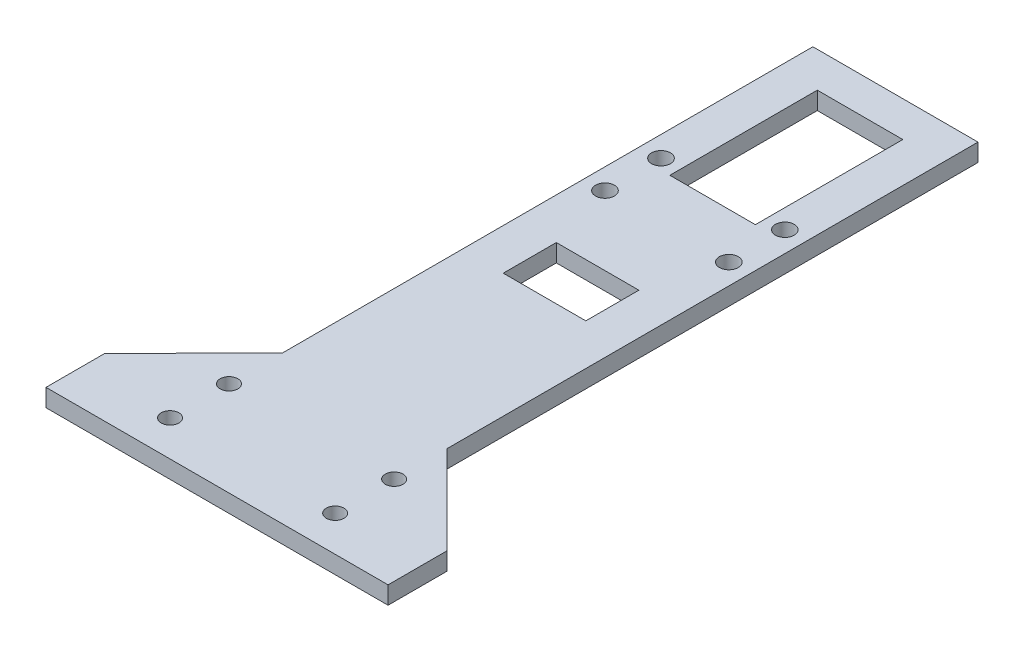
from build123d import *

# Parameters (mm, degrees)
SKETCH1_R           = 1.6
SKETCH1_R_2         = 1.5
SKETCH1_W           = 14
SKETCH1_H           = 9
SKETCH1_W_2         = 14.5
SKETCH1_H_2         = 25
BOSS_EXTRUDE1_DEPTH = 3


with BuildPart() as part:
    # Sketch1 → Boss-Extrude1 (new body)
    with BuildSketch(Plane(origin=(0, 0, 0), x_dir=(1, 0, 0), z_dir=(0, 1, 0))):
        Polygon((0, 0), (0, -90), (15, -105.02919784), (15, -115.02919784), (-43, -115.02919784), (-43, -105.02919784), (-28, -90), (-28, 0), align=None)
        with Locations(Location((-24.5, -38.75, 0), (0, 0, 270))):
            Circle(SKETCH1_R, mode=Mode.SUBTRACT)
        with Locations(Location((-3.5, -38.75, 0), (0, 0, 90))):
            Circle(SKETCH1_R, mode=Mode.SUBTRACT)
        with Locations(Location((-3.5, -29.25, 0), (0, 0, 270))):
            Circle(SKETCH1_R, mode=Mode.SUBTRACT)
        with Locations(Location((-24.5, -29.25, 0), (0, 0, 90))):
            Circle(SKETCH1_R, mode=Mode.SUBTRACT)
        with Locations(Location((-28, -99, 0), (0, 0, 270))):
            Circle(SKETCH1_R_2, mode=Mode.SUBTRACT)
        with Locations(Location((0, -99, 0), (0, 0, 270))):
            Circle(SKETCH1_R_2, mode=Mode.SUBTRACT)
        with Locations(Location((-28, -109, 0), (0, 0, 270))):
            Circle(SKETCH1_R_2, mode=Mode.SUBTRACT)
        with Locations(Location((0, -109, 0), (0, 0, 270))):
            Circle(SKETCH1_R_2, mode=Mode.SUBTRACT)
        with Locations((-14, -55)):
            Rectangle(SKETCH1_W, SKETCH1_H, mode=Mode.SUBTRACT)
        with Locations((-14, -18.5)):
            Rectangle(SKETCH1_W_2, SKETCH1_H_2, mode=Mode.SUBTRACT)
    extrude(amount=BOSS_EXTRUDE1_DEPTH)


solid = part.part
